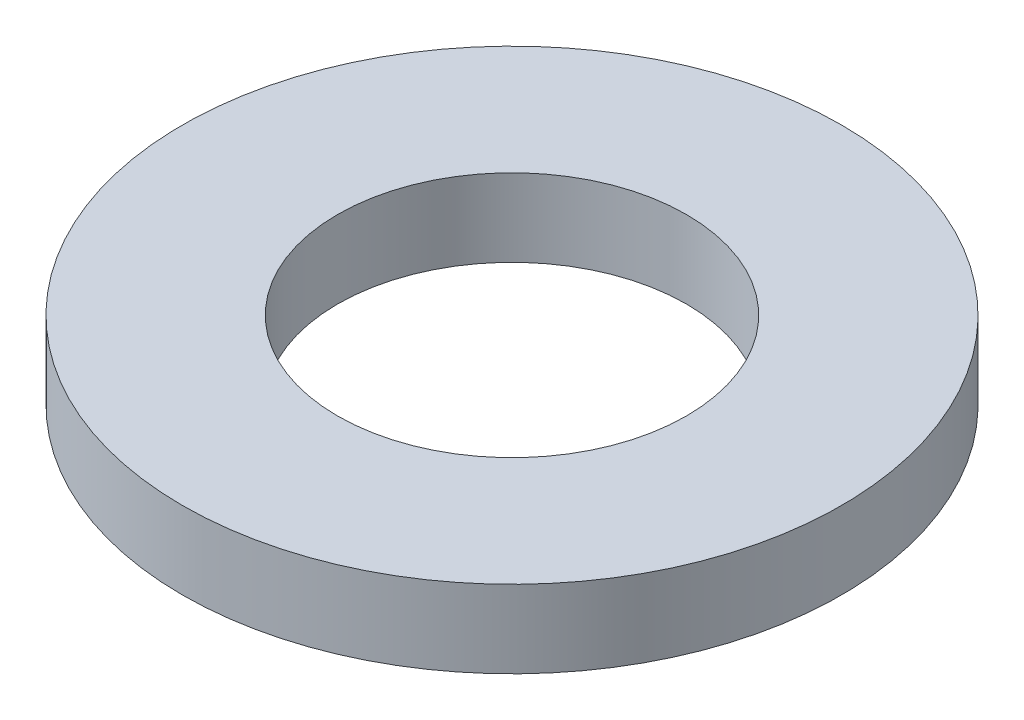
from build123d import *

# Parameters (mm, degrees)
SKETCH1_R           = 53.975
SKETCH1_R_2         = 28.575
BOSS_EXTRUDE1_DEPTH = 12.7


with BuildPart() as part:
    # Sketch1 → Boss-Extrude1 (new body)
    with BuildSketch(Plane(origin=(0, 0, 0), x_dir=(1, 0, 0), z_dir=(0, 1, 0))):
        with Locations(Location((0, 0, 0), (0, 0, 270))):
            Circle(SKETCH1_R)
        with Locations(Location((0, 0, 0), (0, 0, 270))):
            Circle(SKETCH1_R_2, mode=Mode.SUBTRACT)
    extrude(amount=BOSS_EXTRUDE1_DEPTH)


solid = part.part
